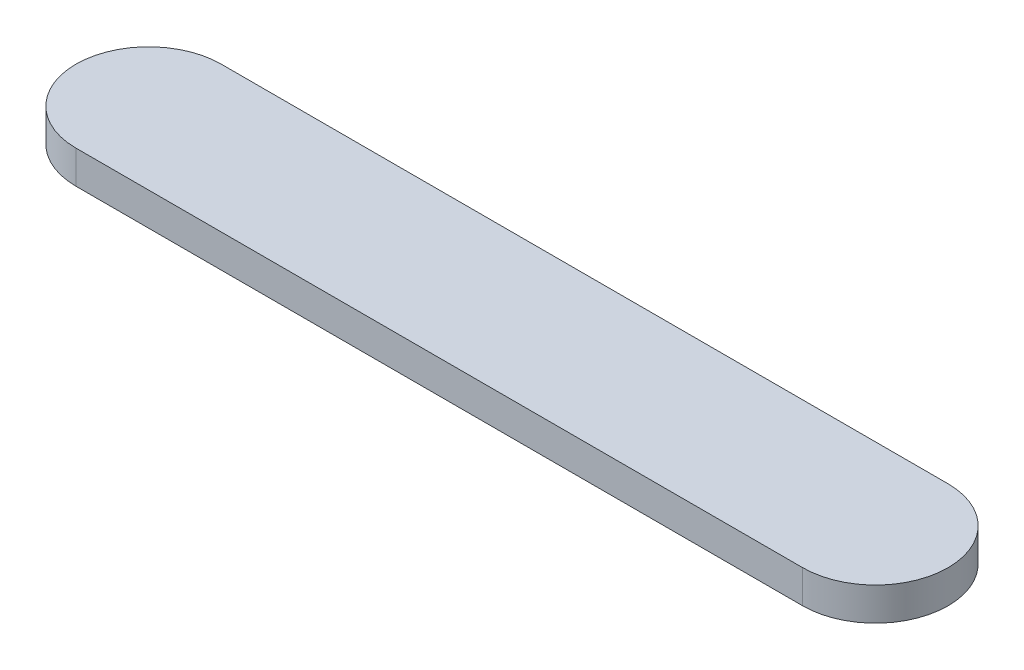
from build123d import *

# Parameters (mm, degrees)
BOSS_EXTRU_1_DEPTH = 5


with BuildPart() as part:
    # Esquisse1 → Boss.-Extru.1 (new body)
    with BuildSketch(Plane(origin=(0, 0, 0), x_dir=(1, 0, 0), z_dir=(0, 1, 0))):
        with BuildLine():
            Line((0, 11), (110, 11))
            ThreePointArc((110, 11), (121, 0), (110, -11))
            Line((110, -11), (0, -11))
            ThreePointArc((0, -11), (-11, 0), (0, 11))
        make_face()
    extrude(amount=BOSS_EXTRU_1_DEPTH)


solid = part.part
